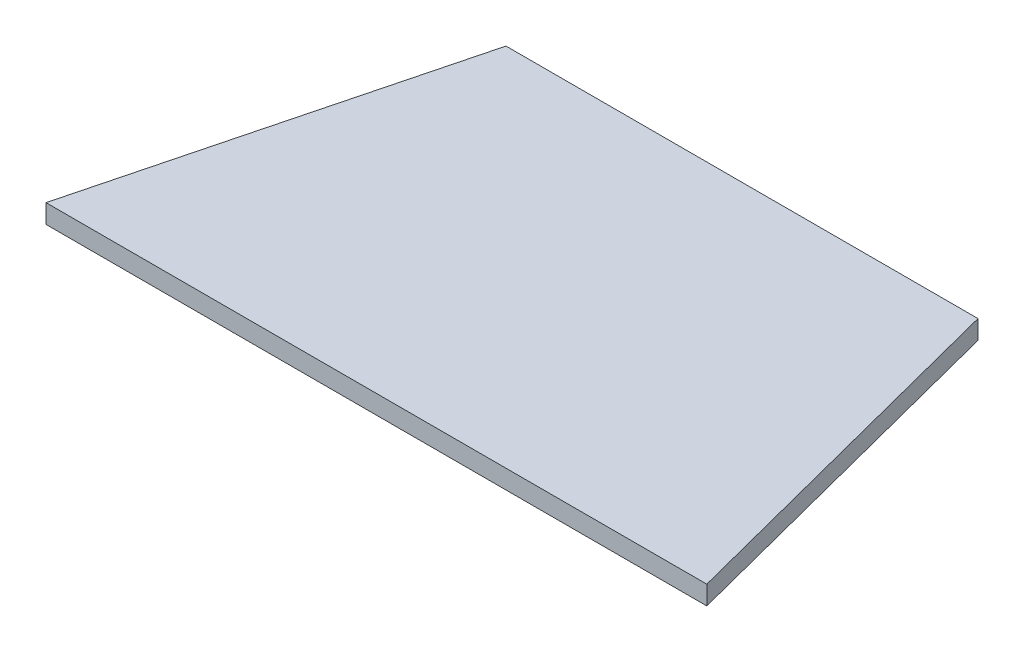
from build123d import *

# Parameters (mm, degrees)
DODANIE_WYCI_GNI_CIE1_DEPTH = 10


with BuildPart() as part:
    # Szkic1 → Dodanie-wyciągnięcie1 (new body)
    with BuildSketch(Plane(origin=(0, 0, 0), x_dir=(1, 0, 0), z_dir=(0, 1, 0))):
        Polygon((-125, 96.824583655), (-175, -96.824583655), (175, -96.824583655), (125, 96.824583655), align=None)
    extrude(amount=DODANIE_WYCI_GNI_CIE1_DEPTH)


solid = part.part
